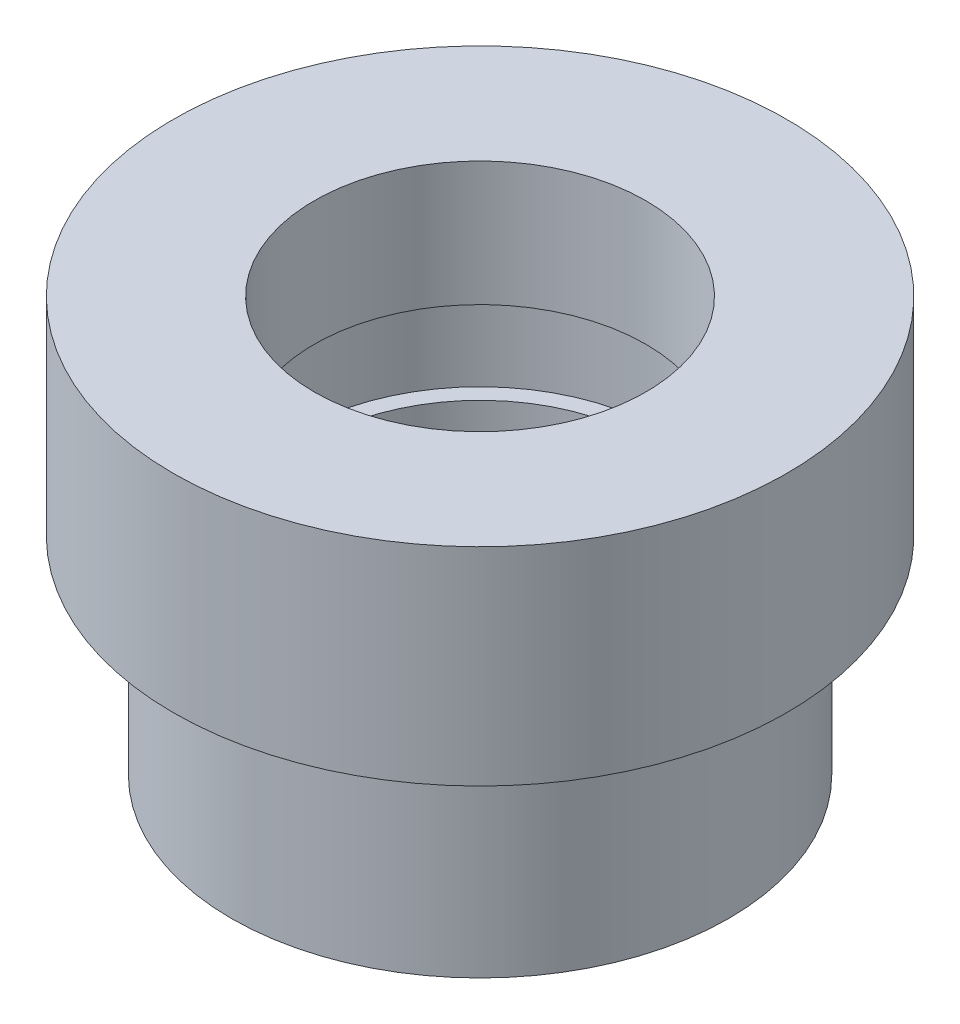
from build123d import *


with BuildPart() as part:
    # Croquis1 → Revolución1 (revolve)
    with BuildSketch(Plane.XY, mode=Mode.PRIVATE) as revoluci_n1_sk:
        Polygon((-20, 25), (-20, 10), (-22, 10), (-22, 0), (-20, 0), (-20, -25), (-30, -25), (-30, 0), (-37, 0), (-37, 25), align=None)
    revolve(revoluci_n1_sk.sketch.rotate(Axis((0, 14.253393665, 0), (0, -1, 0)), 270), axis=Axis((0, 14.253393665, 0), (0, -1, 0)))


solid = part.part
